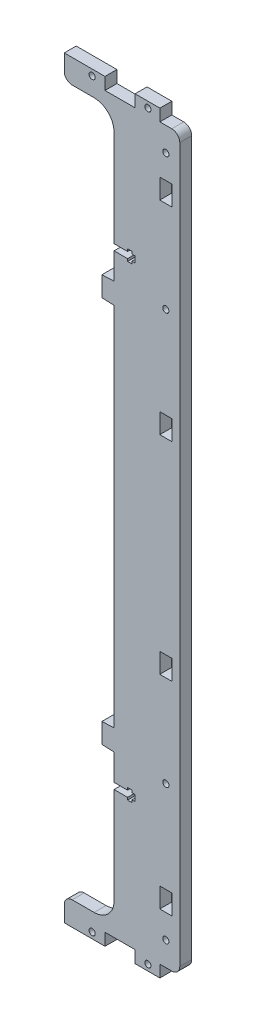
from build123d import *

# Parameters (mm, degrees)
SKETCH_1_R      = 1.55
SKETCH_1_W      = 6.1
SKETCH_1_H      = 10
EXTRUDE_1_DEPTH = 6


with BuildPart() as part:
    # Эскиз1 → Бобышка-Вытянуть1 (new body)
    with BuildSketch(Plane.XY):
        with BuildLine():
            Line((2.8, 115.55), (2.8, 114.35))
            Line((2.8, 114.35), (5, 114.35))
            Line((5, 114.35), (5, 115.55))
            Line((5, 115.55), (6.5, 115.55))
            Line((6.5, 115.55), (6.5, 118.65))
            Line((6.5, 118.65), (5, 118.65))
            Line((5, 118.65), (5, 119.85))
            Line((5, 119.85), (2.8, 119.85))
            Line((2.8, 119.85), (2.8, 118.65))
            Line((2.8, 118.65), (-4, 118.65))
            Line((-4, 118.65), (-4, 167.1))
            ThreePointArc((-4, 167.1), (-6.928932188, 174.171067812), (-14, 177.1))
            Line((-14, 177.1), (-25, 177.1))
            ThreePointArc((-25, 177.1), (-27.828427125, 178.271572875), (-29, 181.1))
            Line((-29, 181.1), (-29, 189.1))
            Line((-29, 189.1), (-8.55, 189.1))
            Line((-8.55, 189.1), (-8.55, 183))
            Line((-8.55, 183), (6.55, 183))
            Line((6.55, 183), (6.55, 189.1))
            Line((6.55, 189.1), (19, 189.1))
            Line((19, 189.1), (19, 183.1))
            Line((19, 183.1), (25, 183.1))
            ThreePointArc((25, 183.1), (27.828427125, 181.928427125), (29, 179.1))
            Line((29, 179.1), (29, -179.1))
            ThreePointArc((29, -179.1), (27.828427125, -181.928427125), (25, -183.1))
            Line((25, -183.1), (19, -183.1))
            Line((19, -183.1), (19, -189.1))
            Line((19, -189.1), (6.55, -189.1))
            Line((6.55, -189.1), (6.55, -183))
            Line((6.55, -183), (-8.55, -183))
            Line((-8.55, -183), (-8.55, -189.1))
            Line((-8.55, -189.1), (-29, -189.1))
            Line((-29, -189.1), (-29, -181.1))
            ThreePointArc((-29, -181.1), (-27.828427125, -178.271572875), (-25, -177.1))
            Line((-25, -177.1), (-14, -177.1))
            ThreePointArc((-14, -177.1), (-6.928932188, -174.171067812), (-4, -167.1))
            Line((-4, -167.1), (-4, -118.65))
            Line((-4, -118.65), (2.8, -118.65))
            Line((2.8, -118.65), (2.8, -119.85))
            Line((2.8, -119.85), (5, -119.85))
            Line((5, -119.85), (5, -118.65))
            Line((5, -118.65), (6.5, -118.65))
            Line((6.5, -118.65), (6.5, -115.55))
            Line((6.5, -115.55), (5, -115.55))
            Line((5, -115.55), (5, -114.35))
            Line((5, -114.35), (2.8, -114.35))
            Line((2.8, -114.35), (2.8, -115.55))
            Line((2.8, -115.55), (-4, -115.55))
            Line((-4, -115.55), (-4, -102.35))
            Line((-4, -102.35), (-10.1, -102.1))
            Line((-10.1, -102.1), (-10.1, -92.1))
            Line((-10.1, -92.1), (-4, -91.85))
            Line((-4, -91.85), (-4, 91.85))
            Line((-4, 91.85), (-10.1, 92.1))
            Line((-10.1, 92.1), (-10.1, 102.1))
            Line((-10.1, 102.1), (-4, 102.35))
            Line((-4, 102.35), (-4, 115.55))
            Line((-4, 115.55), (2.8, 115.55))
        make_face()
        with Locations((-15, 186.1)):
            Circle(SKETCH_1_R, mode=Mode.SUBTRACT)
        with Locations((13, 186.1)):
            Circle(SKETCH_1_R, mode=Mode.SUBTRACT)
        with Locations((22, 103.1)):
            Circle(SKETCH_1_R, mode=Mode.SUBTRACT)
        with Locations((22, 171.1)):
            Circle(SKETCH_1_R, mode=Mode.SUBTRACT)
        with Locations((-15, -186.1)):
            Circle(SKETCH_1_R, mode=Mode.SUBTRACT)
        with Locations((13, -186.1)):
            Circle(SKETCH_1_R, mode=Mode.SUBTRACT)
        with Locations((22, -103.1)):
            Circle(SKETCH_1_R, mode=Mode.SUBTRACT)
        with Locations((22, -171.1)):
            Circle(SKETCH_1_R, mode=Mode.SUBTRACT)
        with Locations((22, 154.1)):
            Rectangle(SKETCH_1_W, SKETCH_1_H, mode=Mode.SUBTRACT)
        with Locations((22, 52.1)):
            Rectangle(SKETCH_1_W, SKETCH_1_H, mode=Mode.SUBTRACT)
        with Locations((22, -154.1)):
            Rectangle(SKETCH_1_W, SKETCH_1_H, mode=Mode.SUBTRACT)
        with Locations((22, -52.1)):
            Rectangle(SKETCH_1_W, SKETCH_1_H, mode=Mode.SUBTRACT)
    extrude(amount=EXTRUDE_1_DEPTH)


solid = part.part
